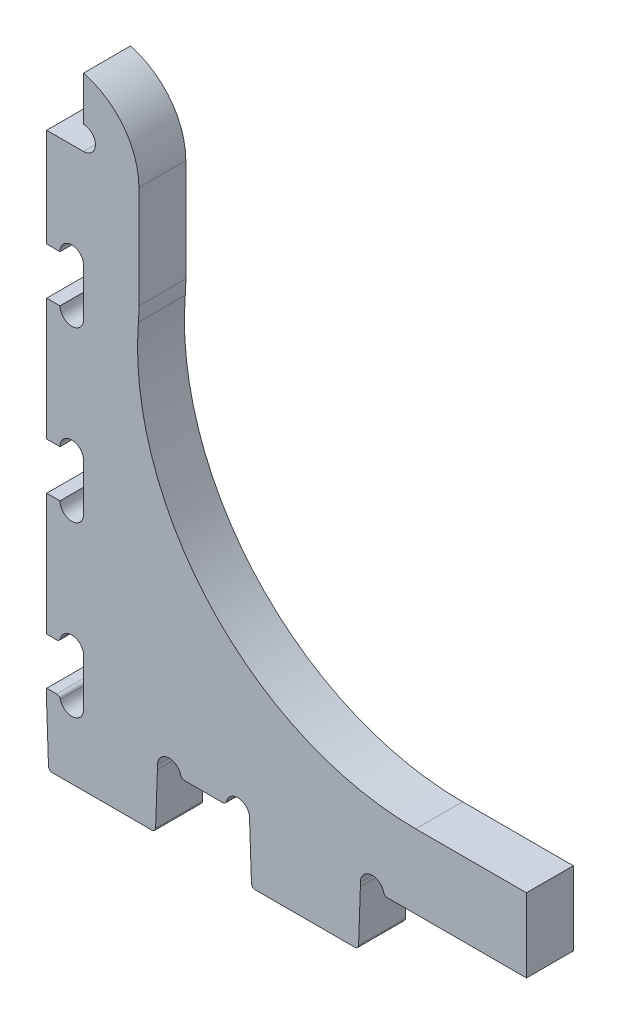
from build123d import *
from OCP.BRepFilletAPI import BRepFilletAPI_MakeChamfer

# Parameters (mm, degrees)
BOSS_EXTRUDE1_DEPTH = 12.7
FILLET1_R           = 50
FILLET2_R           = 20
CUT_EXTRUDE1_DEPTH  = 261.135137957
CHAMFER1_SIZE       = 15
CHAMFER1_SIZE2      = 0.523811542
FILLET3_R           = 1
LPATTERN1_COUNT     = 3
LPATTERN1_PITCH     = 45.77
CUT_EXTRUDE2_DEPTH  = 261.135137957


with BuildPart() as part:
    # Sketch1 → Boss-Extrude1 (new body)
    with BuildSketch(Plane.XY):
        with BuildLine():
            Line((105, 153), (105, 103))
            ThreePointArc((105, 103), (124.067004371, 44.843678649), (180, 20))
            Line((180, 20), (210, 20))
            Line((210, 20), (210, 0))
            Line((210, 0), (171.4, 0))
            ThreePointArc((171.4, 0), (168.2, 3.2), (165, 0))
            Line((165, 0), (165, -16.05))
            Line((165, -16.05), (135, -16.05))
            Line((135, -16.05), (135, 0))
            ThreePointArc((135, 0), (131.8, 3.2), (128.6, 0))
            Line((128.6, 0), (116.4, 0))
            ThreePointArc((116.4, 0), (113.2, 3.2), (110, 0))
            Line((110, 0), (110, -16.05))
            Line((110, -16.05), (80, -16.05))
            Line((80, -16.05), (80, 0))
            Line((80, 0), (80, 153))
            Line((80, 153), (105, 153))
        make_face()
    extrude(amount=BOSS_EXTRUDE1_DEPTH)

    # Fillet1
    fillet1_edges = [part.edges().sort_by_distance(p)[0] for p in [
        (105, 103, 6.35),
    ]]
    fillet(fillet1_edges, radius=FILLET1_R)

    # Fillet2
    fillet2_edges = [part.edges().sort_by_distance(p)[0] for p in [
        (105, 153, 6.35),
    ]]
    fillet(fillet2_edges, radius=FILLET2_R)

    # Sketch2 → Cut-Extrude1 (cut, through all)
    with BuildSketch(Plane.XY.offset(12.7)):
        with BuildLine():
            Line((83.6, 15.7), (80, 15.7))
            Line((80, 15.7), (80, 3))
            Line((80, 3), (83.6, 3))
            ThreePointArc((83.6, 3), (86.8, -0.2), (90, 3))
            Line((90, 3), (90, 15.7))
            ThreePointArc((90, 15.7), (86.8, 18.9), (83.6, 15.7))
        make_face()
    cut_extrude1 = extrude(amount=-CUT_EXTRUDE1_DEPTH, mode=Mode.SUBTRACT)

    # Chamfer1: one chamfer whose edges measure the first distance from different faces: ONE call of the kernel's chamfer builder (chamfer() names one face for all edges)
    chamfer1_edges_1 = [part.edges().sort_by_distance(p)[0] for p in [
        (165, -16.05, 6.35),
    ]]
    chamfer1_side_1 = [part.faces().sort_by_distance(p)[0] for p in [
        (165, -8.025, 6.35),
    ]]
    chamfer1_edges_2 = [part.edges().sort_by_distance(p)[0] for p in [
        (135, -16.05, 6.35),
    ]]
    chamfer1_side_2 = [part.faces().sort_by_distance(p)[0] for p in [
        (135, -8.025, 6.35),
    ]]
    chamfer1_edges_3 = [part.edges().sort_by_distance(p)[0] for p in [
        (110, -16.05, 6.35),
    ]]
    chamfer1_side_3 = [part.faces().sort_by_distance(p)[0] for p in [
        (110, -8.025, 6.35),
    ]]
    chamfer1_edges_4 = [part.edges().sort_by_distance(p)[0] for p in [
        (80, -16.05, 6.35),
    ]]
    chamfer1_side_4 = [part.faces().sort_by_distance(p)[0] for p in [
        (80, -6.525, 6.35),
    ]]
    chamfer1 = BRepFilletAPI_MakeChamfer(part.part.solid().wrapped)
    for e in chamfer1_edges_1:
        chamfer1.Add(CHAMFER1_SIZE, CHAMFER1_SIZE2, e.wrapped, chamfer1_side_1[0].wrapped)  # the first distance lies on this face
    for e in chamfer1_edges_2:
        chamfer1.Add(CHAMFER1_SIZE, CHAMFER1_SIZE2, e.wrapped, chamfer1_side_2[0].wrapped)  # the first distance lies on this face
    for e in chamfer1_edges_3:
        chamfer1.Add(CHAMFER1_SIZE, CHAMFER1_SIZE2, e.wrapped, chamfer1_side_3[0].wrapped)  # the first distance lies on this face
    for e in chamfer1_edges_4:
        chamfer1.Add(CHAMFER1_SIZE, CHAMFER1_SIZE2, e.wrapped, chamfer1_side_4[0].wrapped)  # the first distance lies on this face
    add(Compound.cast(chamfer1.Shape()), mode=Mode.REPLACE)

    # Fillet3
    fillet3_edges = [part.edges().sort_by_distance(p)[0] for p in [
        (171.4, 0, 6.35),
        (128.6, 0, 6.35),
        (116.4, 0, 6.35),
        (83.6, 3, 6.35),
        (83.6, 15.7, 6.35),
        (109.476188458, -16.05, 6.35),
        (80.523811542, -16.05, 6.35),
        (135.523811542, -16.05, 6.35),
        (164.476188458, -16.05, 6.35),
    ]]
    fillet(fillet3_edges, radius=FILLET3_R)

    # LPattern1: Cut-Extrude1 ×3
    with Locations(*[(0, i * LPATTERN1_PITCH, 0) for i in range(1, LPATTERN1_COUNT)]):
        add(cut_extrude1, mode=Mode.SUBTRACT)

    # Sketch3 → Cut-Extrude2 (cut, through all)
    with BuildSketch(Plane.XY.offset(12.7)):
        with BuildLine():
            Line((80, 133.95), (90, 133.95))
            ThreePointArc((90, 133.95), (93.2, 137.15), (90, 140.35))
            Line((90, 140.35), (90, 153))
            Line((90, 153), (80, 153))
            Line((80, 153), (80, 133.95))
        make_face()
    extrude(amount=-CUT_EXTRUDE2_DEPTH, mode=Mode.SUBTRACT)


solid = part.part
